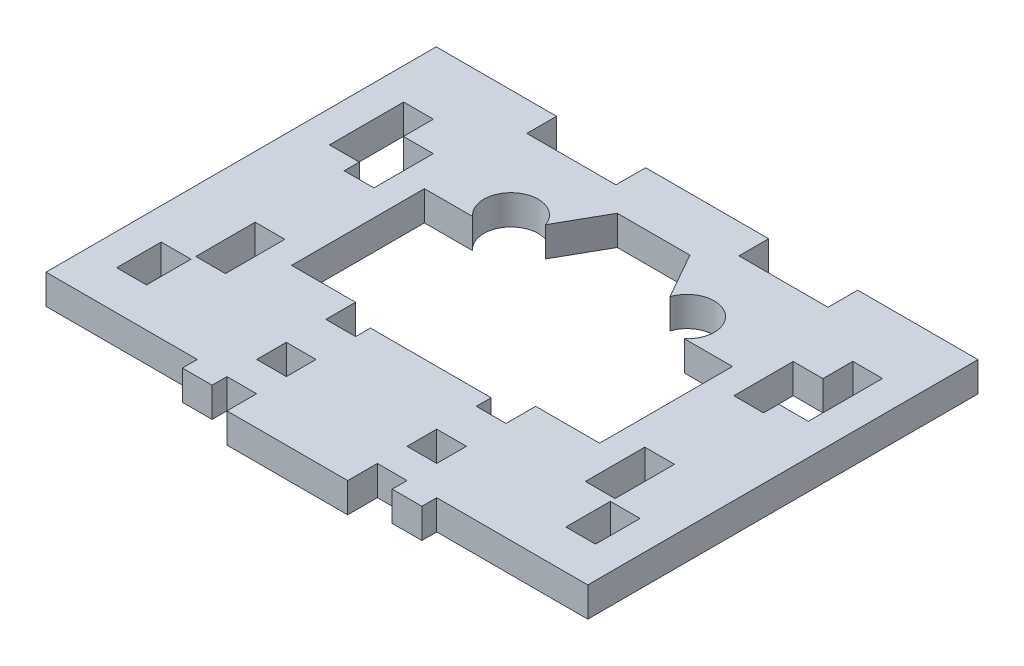
from build123d import *

# Parameters (mm, degrees)
SKETCH1_W           = 6.023507921
SKETCH1_H           = 9
SKETCH1_W_2         = 6
SKETCH1_H_2         = 6
SKETCH1_H_3         = 12
BOSS_EXTRUDE1_DEPTH = 6


with BuildPart() as part:
    # Sketch1 → Boss-Extrude1 (new body)
    with BuildSketch(Plane(origin=(0, 0, 0), x_dir=(1, 0, 0), z_dir=(0, 1, 0))):
        Polygon((-30.457136098, 33.379680679), (-54.770597518, 33.379680679), (-54.770597518, -45.488511926), (-24.197851339, -45.488511926), (-24.197851339, -48.488511926), (-18.197851339, -48.488511926), (-18.197851339, -45.488511926), (-12.197851339, -45.488511926), (-12.197851339, -51.488511926), (12.197851339, -51.488511926), (12.197851339, -45.488511926), (18.197851339, -45.488511926), (18.197851339, -48.488511926), (24.197851339, -48.488511926), (24.197851339, -45.488511926), (54.723581676, -45.488511926), (54.723581676, 33.379680679), (30.410120257, 33.379680679), (30.410120257, 27.379680679), (12.410120257, 27.379680679), (12.410120257, 33.379680679), (-12.457136098, 33.379680679), (-12.457136098, 27.379680679), (-30.457136098, 27.379680679), align=None)
        with Locations((-45.385335637, -33.07427073)):
            Rectangle(SKETCH1_W, SKETCH1_H, mode=Mode.SUBTRACT)
        with Locations((-15.197851339, -36.488511926)):
            Rectangle(SKETCH1_W_2, SKETCH1_H_2, mode=Mode.SUBTRACT)
        with Locations((-39.373581676, -21.614283631)):
            Rectangle(SKETCH1_W_2, SKETCH1_H_3, mode=Mode.SUBTRACT)
        with Locations((15.197851339, -36.488511926)):
            Rectangle(SKETCH1_W_2, SKETCH1_H_2, mode=Mode.SUBTRACT)
        with Locations((45.373581676, -33.07427073)):
            Rectangle(SKETCH1_W_2, SKETCH1_H, mode=Mode.SUBTRACT)
        with Locations((39.373581676, -21.614283631)):
            Rectangle(SKETCH1_W_2, SKETCH1_H_3, mode=Mode.SUBTRACT)
        Polygon((-36.373581676, 2.385716369), (-42.373581676, 2.385716369), (-42.373581676, 5.42572927), (-48.397089597, 5.42572927), (-48.397089597, 20.42572927), (-42.397089597, 20.42572927), (-42.397089597, 14.385716369), (-36.373581676, 14.385716369), align=None, mode=Mode.SUBTRACT)
        with BuildLine():
            Line((-12.587492722, 13.293717765), (-7.349609214, 22.548897144))
            Line((-7.349609214, 22.548897144), (7.326101293, 22.548897144))
            Line((7.326101293, 22.548897144), (12.578685825, 13.267741508))
            ThreePointArc((12.578685825, 13.267741508), (18.679992808, 16.942587364), (23.291850895, 11.51476976))
            ThreePointArc((23.291850895, 11.51476976), (22.796616824, 9.23391071), (21.400098894, 7.363800429))
            Line((21.400098894, 7.363800429), (31.116785699, 7.363800429))
            Line((31.116785699, 7.363800429), (31.116785699, -19.488511926))
            Line((31.116785699, -19.488511926), (18.197851339, -19.488511926))
            Line((18.197851339, -19.488511926), (18.197851339, -25.488511926))
            Line((18.197851339, -25.488511926), (12.197851339, -25.488511926))
            Line((12.197851339, -25.488511926), (12.197851339, -22.488511926))
            Line((12.197851339, -22.488511926), (-12.197851339, -22.488511926))
            Line((-12.197851339, -22.488511926), (-12.197851339, -25.488511926))
            Line((-12.197851339, -25.488511926), (-18.221359259, -25.488511926))
            Line((-18.221359259, -25.488511926), (-18.221359259, -19.488511926))
            Line((-18.221359259, -19.488511926), (-31.140293619, -19.488511926))
            Line((-31.140293619, -19.488511926), (-31.140293619, 7.363800429))
            Line((-31.140293619, 7.363800429), (-21.400098894, 7.363800429))
            ThreePointArc((-21.400098894, 7.363800429), (-20.862334868, 16.077896777), (-12.587492722, 13.293717765))
        make_face(mode=Mode.SUBTRACT)
        Polygon((42.373581676, 2.385716369), (36.373581676, 2.385716369), (36.373581676, 14.385716369), (42.373581676, 14.385716369), (42.373581676, 20.42572927), (48.373581676, 20.42572927), (48.373581676, 5.42572927), (42.373581676, 5.42572927), align=None, mode=Mode.SUBTRACT)
    extrude(amount=BOSS_EXTRUDE1_DEPTH)


solid = part.part
